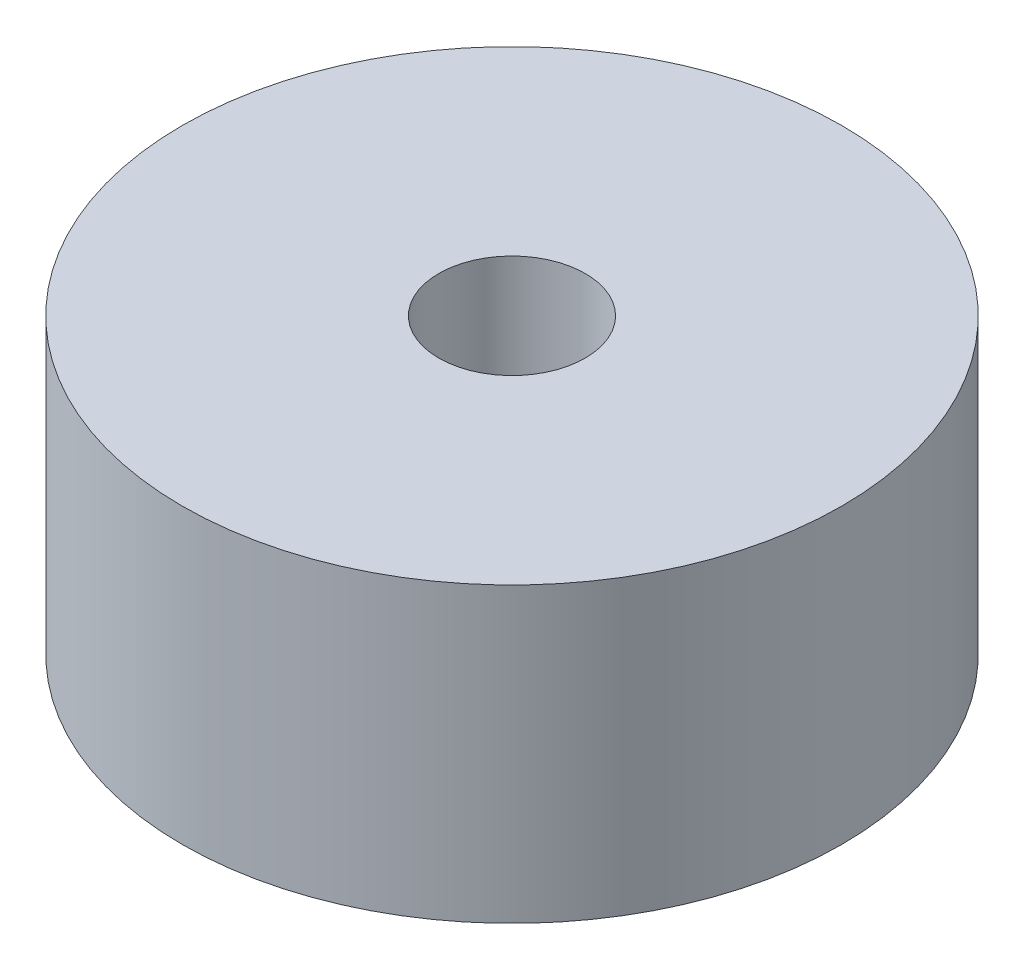
from build123d import *

# Parameters (mm, degrees)
SKETCH1_R           = 18
SKETCH1_R_2         = 4
BOSS_EXTRUDE1_DEPTH = 16


with BuildPart() as part:
    # Sketch1 → Boss-Extrude1 (new body)
    with BuildSketch(Plane(origin=(0, 0, 0), x_dir=(1, 0, 0), z_dir=(0, 1, 0))):
        with Locations(Location((0, 0, 0), (0, 0, 270))):
            Circle(SKETCH1_R)
        with Locations(Location((0, 0, 0), (0, 0, 270))):
            Circle(SKETCH1_R_2, mode=Mode.SUBTRACT)
    extrude(amount=BOSS_EXTRUDE1_DEPTH)


solid = part.part
